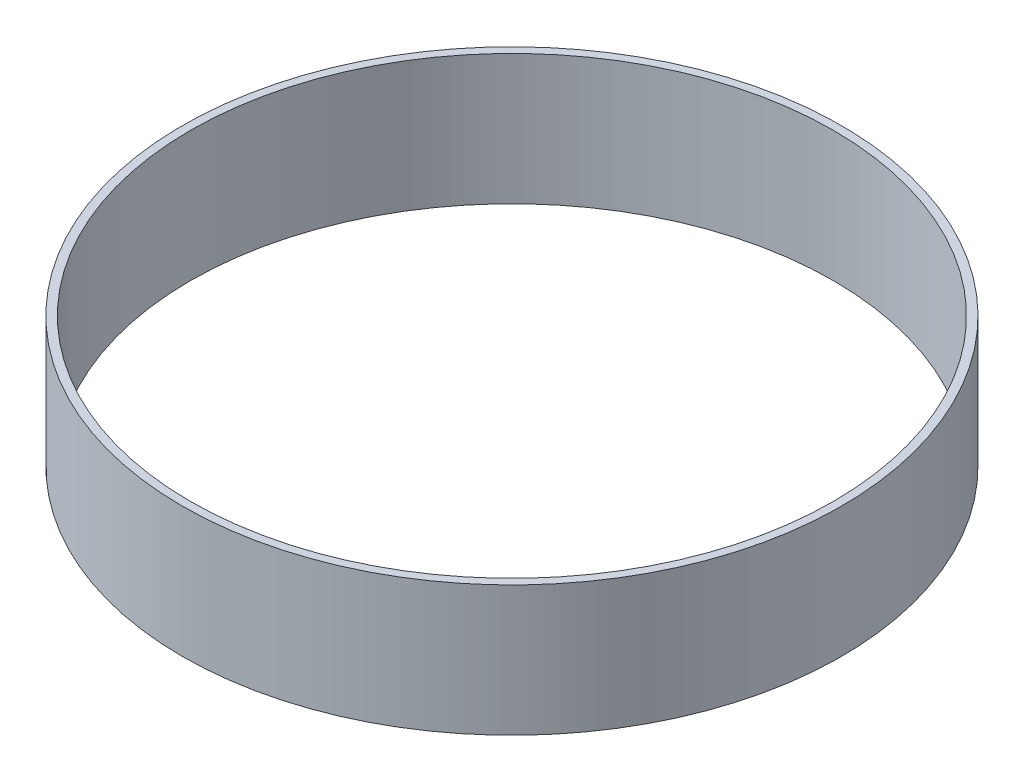
from build123d import *

# Parameters (mm, degrees)
SKETCH1_R           = 40.5
SKETCH1_R_2         = 39.5
BOSS_EXTRUDE1_DEPTH = 16


with BuildPart() as part:
    # Sketch1 → Boss-Extrude1 (new body)
    with BuildSketch(Plane(origin=(0, 0, 0), x_dir=(1, 0, 0), z_dir=(0, 1, 0))):
        with Locations(Location((0, 0, 0), (0, 0, 270))):
            Circle(SKETCH1_R)
        with Locations(Location((0, 0, 0), (0, 0, 270))):
            Circle(SKETCH1_R_2, mode=Mode.SUBTRACT)
    extrude(amount=BOSS_EXTRUDE1_DEPTH)


solid = part.part
